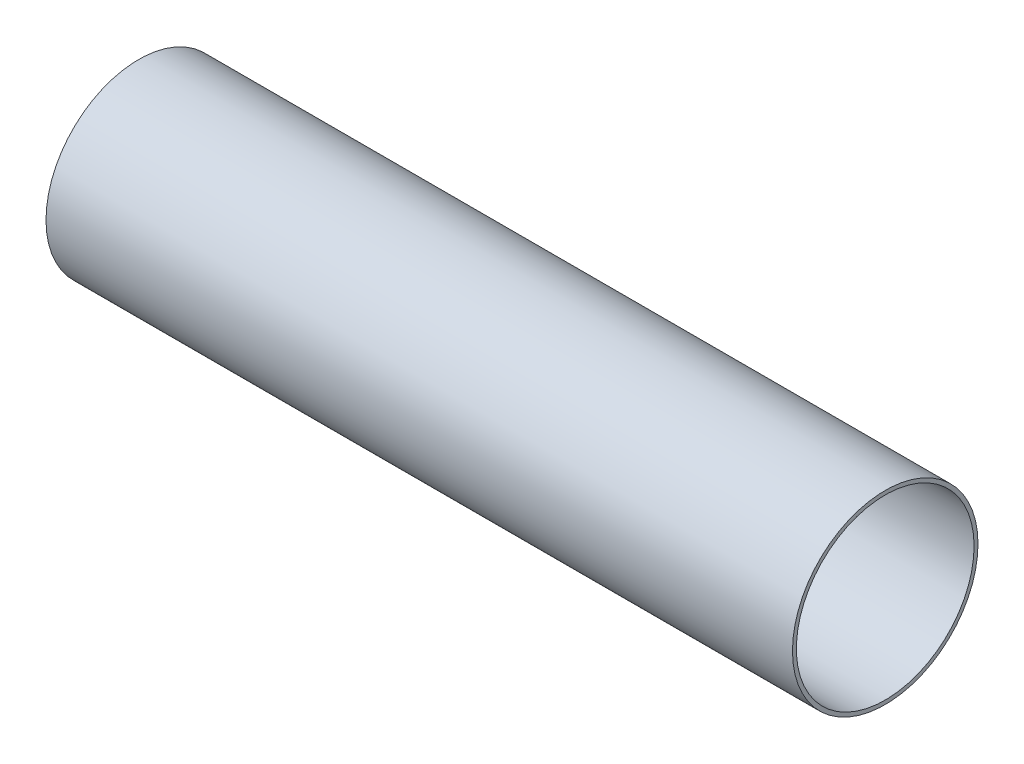
from build123d import *

# Parameters (mm, degrees)
SKETCH1_R           = 26.516477778
SKETCH1_R_2         = 25.4
BOSS_EXTRUDE1_DEPTH = 106.68


with BuildPart() as part:
    # Sketch1 → Boss-Extrude1 (new, symmetric)
    with BuildSketch(Plane(origin=(0, 0, 0), x_dir=(0, 0, -1), z_dir=(1, 0, 0))):
        Circle(SKETCH1_R)
        Circle(SKETCH1_R_2, mode=Mode.SUBTRACT)
    extrude(amount=BOSS_EXTRUDE1_DEPTH, both=True)


solid = part.part
